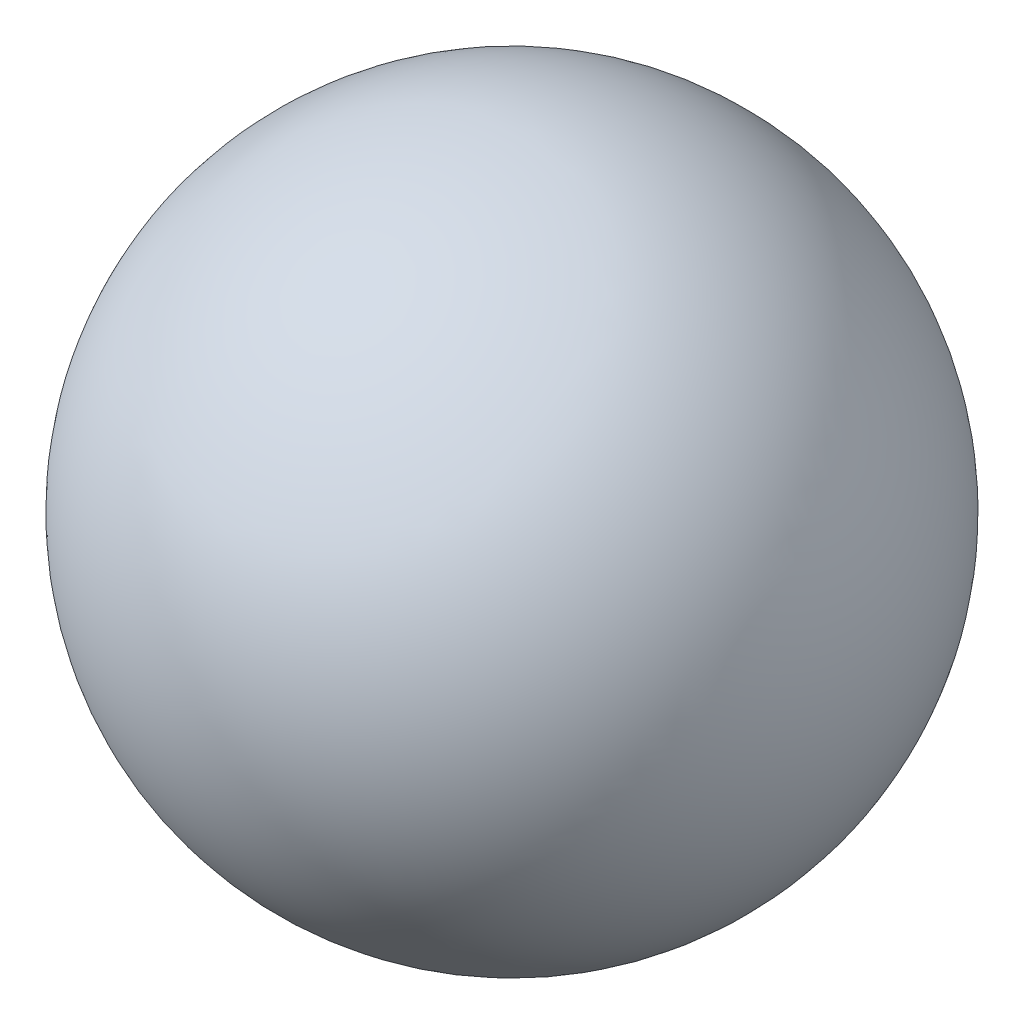
from build123d import *


with BuildPart() as part:
    # Sketch1 → Revolve1 (revolve)
    with BuildSketch(Plane.XY):
        with BuildLine():
            Line((-4, 0), (4, 0))
            ThreePointArc((4, 0), (0, -4), (-4, 0))
        make_face()
    revolve(axis=Axis((-4, 0, 0), (1, 0, 0)))


solid = part.part
